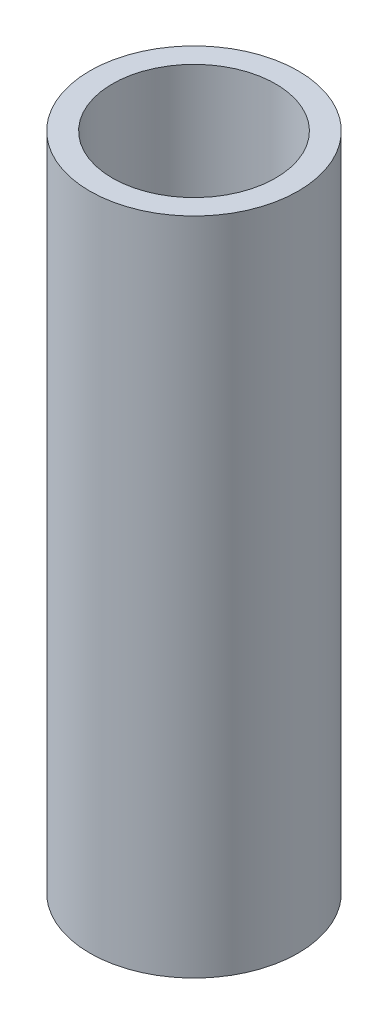
from build123d import *

# Parameters (mm, degrees)
SKETCH1_W = 0.65
SKETCH1_H = 19


with BuildPart() as part:
    # Sketch1 → Revolve1 (revolve)
    with BuildSketch(Plane.XY, mode=Mode.PRIVATE) as revolve1_sk:
        with Locations((-2.675, 9.5)):
            Rectangle(SKETCH1_W, SKETCH1_H)
    revolve(revolve1_sk.sketch.rotate(Axis((0, 21.471409418, 0), (0, -1, 0)), 270), axis=Axis((0, 21.471409418, 0), (0, -1, 0)))


solid = part.part
